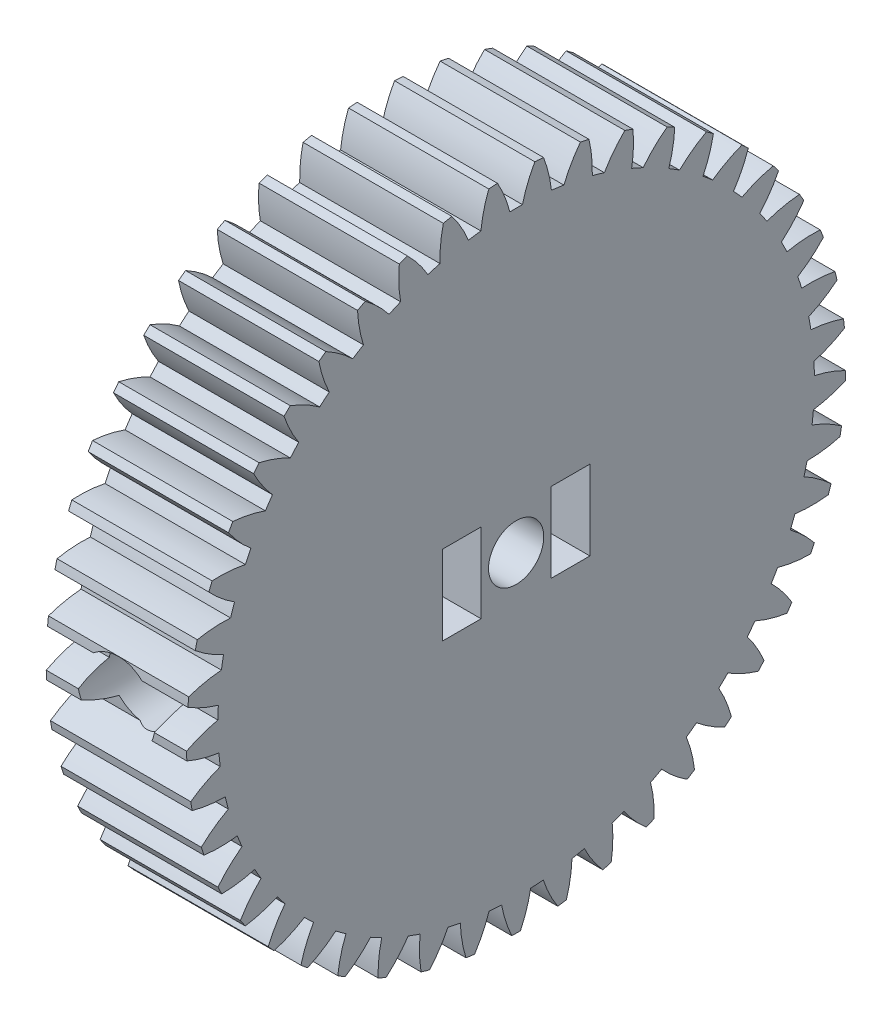
from build123d import *

# Parameters (mm, degrees)
BASPROSKE_W        = 12.7
BASPROSKE_H        = 29.845
TOOTHCUT_DEPTH     = 45.076502243
TEETHCUTS_COUNT    = 45
TEETHCUTS_ANGLE    = 352
BORSKE_R           = 2.5
BORE_DEPTH         = 50.8000508
CUT_EXTRUDE1_START = -1.27
SKETCH1_R          = 2
CUT_EXTRUDE1_DEPTH = 43.801728899
SKETCH2_W          = 3.5
SKETCH2_H          = 7.2
CUT_EXTRUDE4_DEPTH = 45.071728995
CUT_EXTRUDE5_START = -11
SKETCH1_3_R        = 3.5
CUT_EXTRUDE5_DEPTH = 34.071728995


with BuildPart() as part:
    # BasProSke → Base-Revolve (revolve)
    with BuildSketch(Plane(origin=(0, 0, 0), x_dir=(1, 0, 0), z_dir=(0, 1, 0))):
        with Locations((6.35, 14.9225)):
            Rectangle(BASPROSKE_W, BASPROSKE_H)
    revolve(axis=Axis((-10, 0, 0), (1, 0, 0)))

    # TooCutSke → ToothCut (cut, through all)
    with BuildSketch(Plane(origin=(0, 0, 0), x_dir=(0, 0, -1), z_dir=(1, 0, 0))):
        with BuildLine():
            ThreePointArc((0.569798077, 26.99418697), (0, 27.0002), (-0.569798077, 26.99418697))
            ThreePointArc((-0.569798077, 26.99418697), (-1.042025574, 28.445925733), (-1.703505172, 29.821785096))
            ThreePointArc((-1.703505172, 29.821785096), (0, 29.8704), (1.703505172, 29.821785096))
            ThreePointArc((1.703505172, 29.821785096), (1.042025574, 28.445925733), (0.569798077, 26.99418697))
        make_face()
    toothcut = extrude(amount=TOOTHCUT_DEPTH, mode=Mode.SUBTRACT)

    # TeethCuts: ToothCut ×45 about axis
    teethcuts_axis = Axis((-10, 0, 0), (1, 0, 0))
    for i in range(1, TEETHCUTS_COUNT):
        add(toothcut.rotate(teethcuts_axis, i * TEETHCUTS_ANGLE / (TEETHCUTS_COUNT - 1)), mode=Mode.SUBTRACT)

    # BorSke → Bore (cut, symmetric)
    with BuildSketch(Plane(origin=(0, 0, 0), x_dir=(0, 0, -1), z_dir=(1, 0, 0))):
        Circle(BORSKE_R)
    extrude(amount=BORE_DEPTH, both=True, mode=Mode.SUBTRACT)

    # Sketch1 → Cut-Extrude1 (cut, through all)
    with BuildSketch(Plane.XY.offset(CUT_EXTRUDE1_START)):
        with Locations((6.35, 0)):
            Circle(SKETCH1_R)
    cut_extrude1 = extrude(amount=-CUT_EXTRUDE1_DEPTH, mode=Mode.SUBTRACT)

    # Sketch2 → Cut-Extrude4 (cut, through all)
    with BuildSketch(Plane(origin=(12.7, 0, 0), x_dir=(0, 0, -1), z_dir=(1, 0, 0))):
        with Locations((4.925, 0)):
            Rectangle(SKETCH2_W, SKETCH2_H)
    cut_extrude4 = extrude(amount=-CUT_EXTRUDE4_DEPTH, mode=Mode.SUBTRACT)

    # Sketch1<3> → Cut-Extrude5 (cut, through all)
    with BuildSketch(Plane.XY.offset(CUT_EXTRUDE5_START)):
        with Locations((6.35, 0)):
            Circle(SKETCH1_3_R)
    cut_extrude5 = extrude(amount=-CUT_EXTRUDE5_DEPTH, mode=Mode.SUBTRACT)

    # Mirror1: Cut-Extrude1, Cut-Extrude4, Cut-Extrude5 across plane
    add(cut_extrude1.mirror(Plane.XY), mode=Mode.SUBTRACT)
    add(cut_extrude4.mirror(Plane.XY), mode=Mode.SUBTRACT)
    add(cut_extrude5.mirror(Plane.XY), mode=Mode.SUBTRACT)


solid = part.part
